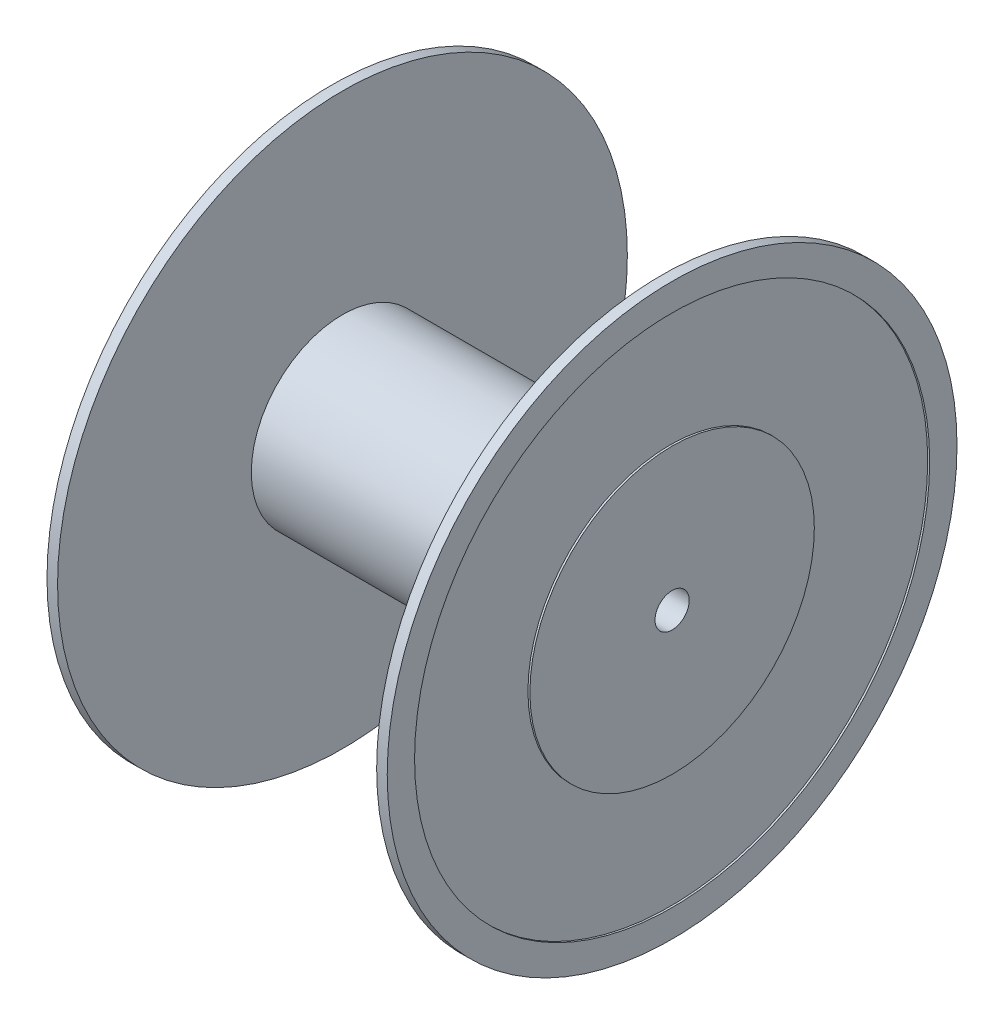
from build123d import *

# Parameters (mm, degrees)
SKETCH1_R           = 25.4
BOSS_EXTRUDE1_DEPTH = 44.45
SKETCH2_R           = 79.375
BOSS_EXTRUDE2_DEPTH = 2.4003
SKETCH3_R           = 79.375
SKETCH3_R_2         = 71.755
BOSS_EXTRUDE3_DEPTH = 0.5461
SKETCH4_R           = 39.624
BOSS_EXTRUDE4_DEPTH = 0.5461
SKETCH5_R           = 4.7625
CUT_EXTRUDE1_DEPTH  = 122.849086919


with BuildPart() as part:
    # Sketch1 → Boss-Extrude1 (new body)
    with BuildSketch(Plane(origin=(0, 0, 0), x_dir=(0, 0, -1), z_dir=(1, 0, 0))):
        Circle(SKETCH1_R)
    boss_extrude1 = extrude(amount=BOSS_EXTRUDE1_DEPTH)

    # Sketch2 → Boss-Extrude2 (add)
    with BuildSketch(Plane(origin=(44.45, 0, 0), x_dir=(0, 0, -1), z_dir=(1, 0, 0))):
        Circle(SKETCH2_R)
    boss_extrude2 = extrude(amount=BOSS_EXTRUDE2_DEPTH)

    # Sketch3 → Boss-Extrude3 (add)
    with BuildSketch(Plane(origin=(46.8503, 0, 0), x_dir=(0, 0, -1), z_dir=(1, 0, 0))):
        Circle(SKETCH3_R)
        Circle(SKETCH3_R_2, mode=Mode.SUBTRACT)
    boss_extrude3 = extrude(amount=BOSS_EXTRUDE3_DEPTH)

    # Sketch4 → Boss-Extrude4 (add)
    with BuildSketch(Plane(origin=(46.8503, 0, 0), x_dir=(0, 0, -1), z_dir=(1, 0, 0))):
        Circle(SKETCH4_R)
    boss_extrude4 = extrude(amount=BOSS_EXTRUDE4_DEPTH)

    # Sketch5 → Cut-Extrude1 (cut, through all)
    with BuildSketch(Plane(origin=(47.3964, 0, 0), x_dir=(0, 0, -1), z_dir=(1, 0, 0))):
        Circle(SKETCH5_R)
    cut_extrude1 = extrude(amount=-CUT_EXTRUDE1_DEPTH, mode=Mode.SUBTRACT)

    # Mirror1: Boss-Extrude1, Boss-Extrude2, Boss-Extrude3, Boss-Extrude4, Cut-Extrude1 across plane
    add(boss_extrude1.mirror(Plane(origin=(0, 0, 0), x_dir=(0, 0, 1), z_dir=(1, 0, 0))))
    add(boss_extrude2.mirror(Plane(origin=(0, 0, 0), x_dir=(0, 0, 1), z_dir=(1, 0, 0))))
    add(boss_extrude3.mirror(Plane(origin=(0, 0, 0), x_dir=(0, 0, 1), z_dir=(1, 0, 0))))
    add(boss_extrude4.mirror(Plane(origin=(0, 0, 0), x_dir=(0, 0, 1), z_dir=(1, 0, 0))))
    add(cut_extrude1.mirror(Plane(origin=(0, 0, 0), x_dir=(0, 0, 1), z_dir=(1, 0, 0))), mode=Mode.SUBTRACT)


solid = part.part
